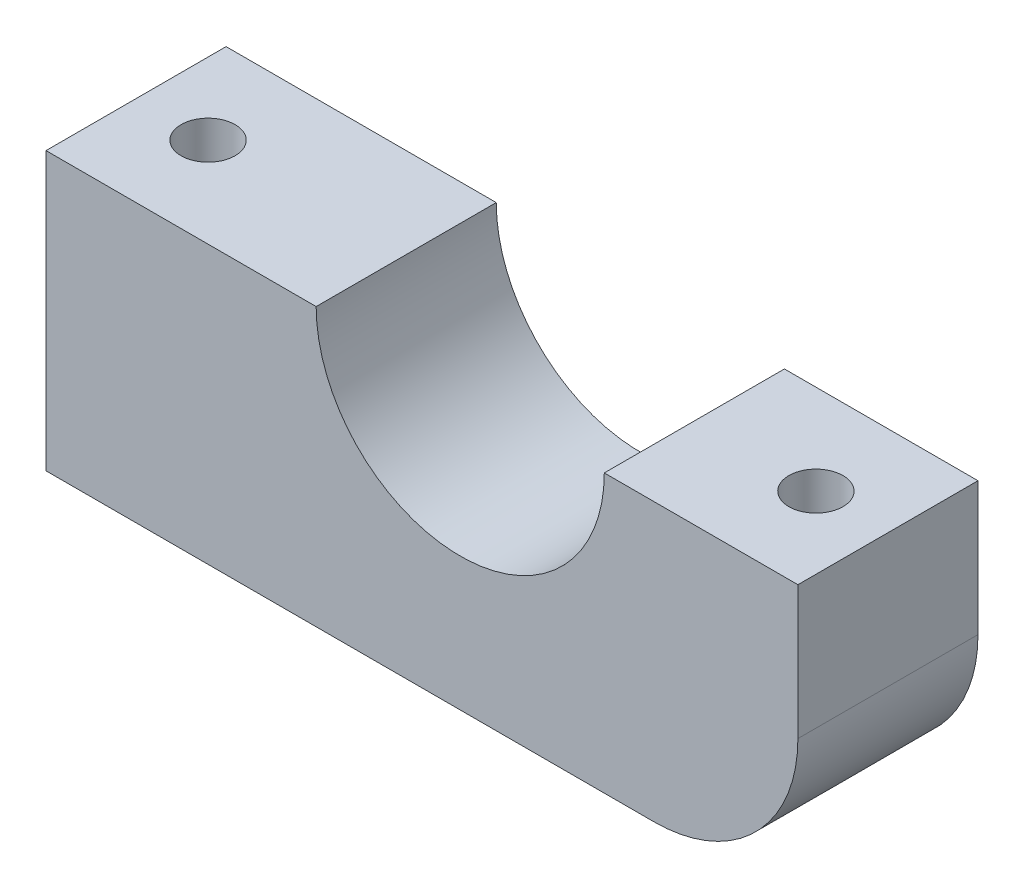
from build123d import *

# Parameters (mm, degrees)
BOSS_EXTRUDE1_DEPTH = 10
SKETCH2_R           = 1.5
CUT_EXTRUDE1_DEPTH  = 46.609456256


with BuildPart() as part:
    # Sketch1 → Boss-Extrude1 (new body)
    with BuildSketch(Plane.XY):
        with BuildLine():
            Line((0, 0), (-10.75, 0))
            ThreePointArc((-10.75, 0), (-18.75, -8), (-26.75, 0))
            Line((-26.75, 0), (-41.75, 0))
            Line((-41.75, 0), (-41.75, -15.4))
            Line((-41.75, -15.4), (-8, -15.4))
            ThreePointArc((-8, -15.4), (-2.343145751, -13.056854249), (0, -7.4))
            Line((0, -7.4), (0, 0))
        make_face()
    extrude(amount=BOSS_EXTRUDE1_DEPTH)

    # Sketch2 → Cut-Extrude1 (cut, through all)
    with BuildSketch(Plane.XZ.offset(15.4)):
        with Locations(Location((-37.75, 5, 0), (0, 0, 270))):
            Circle(SKETCH2_R)
        with Locations(Location((-4, 5, 0), (0, 0, 270))):
            Circle(SKETCH2_R)
    extrude(amount=-CUT_EXTRUDE1_DEPTH, mode=Mode.SUBTRACT)


solid = part.part
